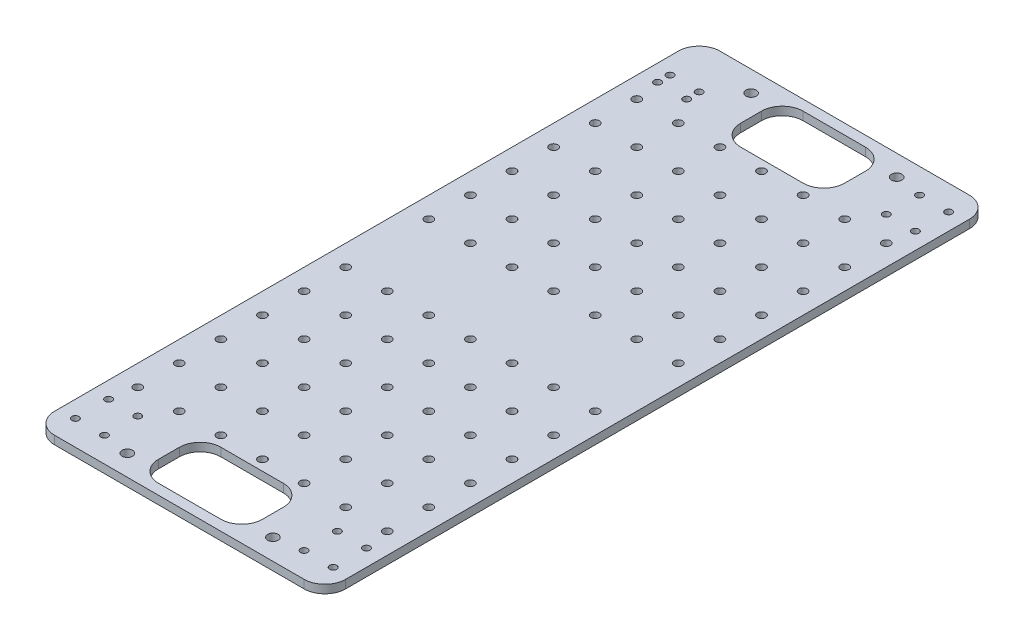
from build123d import *

# Parameters (mm, degrees)
SKETCH_1_R      = 1.7
SKETCH_1_R_2    = 2
SKETCH_1_R_3    = 2.5
EXTRUDE_2_DEPTH = 4


with BuildPart() as part:
    # 草图1 → 凸台-拉伸2 (new body)
    with BuildSketch(Plane(origin=(0, 0, 0), x_dir=(1, 0, 0), z_dir=(0, 1, 0))):
        with BuildLine():
            Line((60, 160), (0, 160))
            Line((0, 160), (-60, 160))
            ThreePointArc((-60, 160), (-67.071067812, 157.071067812), (-70, 150))
            Line((-70, 150), (-70, 0))
            Line((-70, 0), (-70, -150))
            ThreePointArc((-70, -150), (-67.071067812, -157.071067812), (-60, -160))
            Line((-60, -160), (60, -160))
            ThreePointArc((60, -160), (67.071067812, -157.071067812), (70, -150))
            Line((70, -150), (70, 150))
            ThreePointArc((70, 150), (67.071067812, 157.071067812), (60, 160))
        make_face()
        with Locations(Location((-62, 132, 0), (0, 0, 270))):
            Circle(SKETCH_1_R, mode=Mode.SUBTRACT)
        with Locations(Location((-62, -148, 0), (0, 0, 270))):
            Circle(SKETCH_1_R, mode=Mode.SUBTRACT)
        with Locations(Location((-48, -148, 0), (0, 0, 270))):
            Circle(SKETCH_1_R, mode=Mode.SUBTRACT)
        with Locations(Location((-62, -132, 0), (0, 0, 270))):
            Circle(SKETCH_1_R, mode=Mode.SUBTRACT)
        with Locations(Location((-60, -120, 0), (0, 0, 270))):
            Circle(SKETCH_1_R_2, mode=Mode.SUBTRACT)
        with Locations(Location((-48, -132, 0), (0, 0, 270))):
            Circle(SKETCH_1_R, mode=Mode.SUBTRACT)
        with Locations(Location((-35, -150, 0), (0, 0, 270))):
            Circle(SKETCH_1_R_3, mode=Mode.SUBTRACT)
        with Locations(Location((-40, -120, 0), (0, 0, 270))):
            Circle(SKETCH_1_R_2, mode=Mode.SUBTRACT)
        with Locations(Location((-60, -100, 0), (0, 0, 270))):
            Circle(SKETCH_1_R_2, mode=Mode.SUBTRACT)
        with Locations(Location((-60, -80, 0), (0, 0, 270))):
            Circle(SKETCH_1_R_2, mode=Mode.SUBTRACT)
        with Locations(Location((-40, -100, 0), (0, 0, 270))):
            Circle(SKETCH_1_R_2, mode=Mode.SUBTRACT)
        with Locations(Location((-40, -80, 0), (0, 0, 270))):
            Circle(SKETCH_1_R_2, mode=Mode.SUBTRACT)
        with Locations(Location((-20, -120, 0), (0, 0, 270))):
            Circle(SKETCH_1_R_2, mode=Mode.SUBTRACT)
        with BuildLine():
            ThreePointArc((15, -125), (22.071067812, -127.928932188), (25, -135))
            Line((25, -135), (25, -145))
            ThreePointArc((25, -145), (22.071067812, -152.071067812), (15, -155))
            Line((15, -155), (-15, -155))
            ThreePointArc((-15, -155), (-22.071067812, -152.071067812), (-25, -145))
            Line((-25, -145), (-25, -135))
            ThreePointArc((-25, -135), (-22.071067812, -127.928932188), (-15, -125))
            Line((-15, -125), (15, -125))
        make_face(mode=Mode.SUBTRACT)
        with Locations(Location((0, -120, 0), (0, 0, 270))):
            Circle(SKETCH_1_R_2, mode=Mode.SUBTRACT)
        with Locations(Location((-20, -100, 0), (0, 0, 270))):
            Circle(SKETCH_1_R_2, mode=Mode.SUBTRACT)
        with Locations(Location((-20, -80, 0), (0, 0, 270))):
            Circle(SKETCH_1_R_2, mode=Mode.SUBTRACT)
        with Locations(Location((0, -100, 0), (0, 0, 270))):
            Circle(SKETCH_1_R_2, mode=Mode.SUBTRACT)
        with Locations(Location((0, -80, 0), (0, 0, 270))):
            Circle(SKETCH_1_R_2, mode=Mode.SUBTRACT)
        with Locations(Location((-60, -60, 0), (0, 0, 270))):
            Circle(SKETCH_1_R_2, mode=Mode.SUBTRACT)
        with Locations(Location((-60, -40, 0), (0, 0, 270))):
            Circle(SKETCH_1_R_2, mode=Mode.SUBTRACT)
        with Locations(Location((-40, -60, 0), (0, 0, 270))):
            Circle(SKETCH_1_R_2, mode=Mode.SUBTRACT)
        with Locations(Location((-40, -40, 0), (0, 0, 270))):
            Circle(SKETCH_1_R_2, mode=Mode.SUBTRACT)
        with Locations(Location((-60, -20, 0), (0, 0, 270))):
            Circle(SKETCH_1_R_2, mode=Mode.SUBTRACT)
        with Locations(Location((-40, -20, 0), (0, 0, 270))):
            Circle(SKETCH_1_R_2, mode=Mode.SUBTRACT)
        with Locations(Location((-20, -60, 0), (0, 0, 270))):
            Circle(SKETCH_1_R_2, mode=Mode.SUBTRACT)
        with Locations(Location((-20, -40, 0), (0, 0, 270))):
            Circle(SKETCH_1_R_2, mode=Mode.SUBTRACT)
        with Locations(Location((0, -60, 0), (0, 0, 270))):
            Circle(SKETCH_1_R_2, mode=Mode.SUBTRACT)
        with Locations(Location((0, -40, 0), (0, 0, 270))):
            Circle(SKETCH_1_R_2, mode=Mode.SUBTRACT)
        with Locations(Location((-20, -20, 0), (0, 0, 270))):
            Circle(SKETCH_1_R_2, mode=Mode.SUBTRACT)
        with Locations(Location((0, -20, 0), (0, 0, 270))):
            Circle(SKETCH_1_R_2, mode=Mode.SUBTRACT)
        with Locations(Location((20, -120, 0), (0, 0, 270))):
            Circle(SKETCH_1_R_2, mode=Mode.SUBTRACT)
        with Locations(Location((20, -100, 0), (0, 0, 270))):
            Circle(SKETCH_1_R_2, mode=Mode.SUBTRACT)
        with Locations(Location((20, -80, 0), (0, 0, 270))):
            Circle(SKETCH_1_R_2, mode=Mode.SUBTRACT)
        with Locations(Location((35, -150, 0), (0, 0, 270))):
            Circle(SKETCH_1_R_3, mode=Mode.SUBTRACT)
        with Locations(Location((40, -120, 0), (0, 0, 270))):
            Circle(SKETCH_1_R_2, mode=Mode.SUBTRACT)
        with Locations(Location((48, -148, 0), (0, 0, 270))):
            Circle(SKETCH_1_R, mode=Mode.SUBTRACT)
        with Locations(Location((62, -148, 0), (0, 0, 270))):
            Circle(SKETCH_1_R, mode=Mode.SUBTRACT)
        with Locations(Location((48, -132, 0), (0, 0, 270))):
            Circle(SKETCH_1_R, mode=Mode.SUBTRACT)
        with Locations(Location((62, -132, 0), (0, 0, 270))):
            Circle(SKETCH_1_R, mode=Mode.SUBTRACT)
        with Locations(Location((60, -120, 0), (0, 0, 270))):
            Circle(SKETCH_1_R_2, mode=Mode.SUBTRACT)
        with Locations(Location((40, -100, 0), (0, 0, 270))):
            Circle(SKETCH_1_R_2, mode=Mode.SUBTRACT)
        with Locations(Location((40, -80, 0), (0, 0, 270))):
            Circle(SKETCH_1_R_2, mode=Mode.SUBTRACT)
        with Locations(Location((60, -100, 0), (0, 0, 270))):
            Circle(SKETCH_1_R_2, mode=Mode.SUBTRACT)
        with Locations(Location((60, -80, 0), (0, 0, 270))):
            Circle(SKETCH_1_R_2, mode=Mode.SUBTRACT)
        with Locations(Location((20, -60, 0), (0, 0, 270))):
            Circle(SKETCH_1_R_2, mode=Mode.SUBTRACT)
        with Locations(Location((20, -40, 0), (0, 0, 270))):
            Circle(SKETCH_1_R_2, mode=Mode.SUBTRACT)
        with Locations(Location((20, -20, 0), (0, 0, 270))):
            Circle(SKETCH_1_R_2, mode=Mode.SUBTRACT)
        with Locations(Location((40, -60, 0), (0, 0, 270))):
            Circle(SKETCH_1_R_2, mode=Mode.SUBTRACT)
        with Locations(Location((40, -40, 0), (0, 0, 270))):
            Circle(SKETCH_1_R_2, mode=Mode.SUBTRACT)
        with Locations(Location((60, -60, 0), (0, 0, 270))):
            Circle(SKETCH_1_R_2, mode=Mode.SUBTRACT)
        with Locations(Location((60, -40, 0), (0, 0, 270))):
            Circle(SKETCH_1_R_2, mode=Mode.SUBTRACT)
        with Locations(Location((40, -20, 0), (0, 0, 270))):
            Circle(SKETCH_1_R_2, mode=Mode.SUBTRACT)
        with Locations(Location((60, -20, 0), (0, 0, 270))):
            Circle(SKETCH_1_R_2, mode=Mode.SUBTRACT)
        with Locations(Location((-60, 20, 0), (0, 0, 270))):
            Circle(SKETCH_1_R_2, mode=Mode.SUBTRACT)
        with Locations(Location((-40, 20, 0), (0, 0, 270))):
            Circle(SKETCH_1_R_2, mode=Mode.SUBTRACT)
        with Locations(Location((-60, 40, 0), (0, 0, 270))):
            Circle(SKETCH_1_R_2, mode=Mode.SUBTRACT)
        with Locations(Location((-60, 60, 0), (0, 0, 270))):
            Circle(SKETCH_1_R_2, mode=Mode.SUBTRACT)
        with Locations(Location((-40, 40, 0), (0, 0, 270))):
            Circle(SKETCH_1_R_2, mode=Mode.SUBTRACT)
        with Locations(Location((-40, 60, 0), (0, 0, 270))):
            Circle(SKETCH_1_R_2, mode=Mode.SUBTRACT)
        with Locations(Location((-20, 20, 0), (0, 0, 270))):
            Circle(SKETCH_1_R_2, mode=Mode.SUBTRACT)
        with Locations(Location((0, 20, 0), (0, 0, 270))):
            Circle(SKETCH_1_R_2, mode=Mode.SUBTRACT)
        with Locations(Location((-20, 40, 0), (0, 0, 270))):
            Circle(SKETCH_1_R_2, mode=Mode.SUBTRACT)
        with Locations(Location((-20, 60, 0), (0, 0, 270))):
            Circle(SKETCH_1_R_2, mode=Mode.SUBTRACT)
        with Locations(Location((0, 40, 0), (0, 0, 270))):
            Circle(SKETCH_1_R_2, mode=Mode.SUBTRACT)
        with Locations(Location((0, 60, 0), (0, 0, 270))):
            Circle(SKETCH_1_R_2, mode=Mode.SUBTRACT)
        with Locations(Location((-60, 80, 0), (0, 0, 270))):
            Circle(SKETCH_1_R_2, mode=Mode.SUBTRACT)
        with Locations(Location((-60, 100, 0), (0, 0, 270))):
            Circle(SKETCH_1_R_2, mode=Mode.SUBTRACT)
        with Locations(Location((-40, 80, 0), (0, 0, 270))):
            Circle(SKETCH_1_R_2, mode=Mode.SUBTRACT)
        with Locations(Location((-40, 100, 0), (0, 0, 270))):
            Circle(SKETCH_1_R_2, mode=Mode.SUBTRACT)
        with Locations(Location((-60, 120, 0), (0, 0, 270))):
            Circle(SKETCH_1_R_2, mode=Mode.SUBTRACT)
        with Locations(Location((-48, 132, 0), (0, 0, 270))):
            Circle(SKETCH_1_R, mode=Mode.SUBTRACT)
        with Locations(Location((-62, 138, 0), (0, 0, 270))):
            Circle(SKETCH_1_R, mode=Mode.SUBTRACT)
        with Locations(Location((-48, 138, 0), (0, 0, 270))):
            Circle(SKETCH_1_R, mode=Mode.SUBTRACT)
        with Locations(Location((-40, 120, 0), (0, 0, 270))):
            Circle(SKETCH_1_R_2, mode=Mode.SUBTRACT)
        with Locations(Location((-35, 150, 0), (0, 0, 270))):
            Circle(SKETCH_1_R_3, mode=Mode.SUBTRACT)
        with Locations(Location((-20, 80, 0), (0, 0, 270))):
            Circle(SKETCH_1_R_2, mode=Mode.SUBTRACT)
        with Locations(Location((-20, 100, 0), (0, 0, 270))):
            Circle(SKETCH_1_R_2, mode=Mode.SUBTRACT)
        with Locations(Location((0, 80, 0), (0, 0, 270))):
            Circle(SKETCH_1_R_2, mode=Mode.SUBTRACT)
        with Locations(Location((0, 100, 0), (0, 0, 270))):
            Circle(SKETCH_1_R_2, mode=Mode.SUBTRACT)
        with Locations(Location((-20, 120, 0), (0, 0, 270))):
            Circle(SKETCH_1_R_2, mode=Mode.SUBTRACT)
        with Locations(Location((0, 120, 0), (0, 0, 270))):
            Circle(SKETCH_1_R_2, mode=Mode.SUBTRACT)
        with BuildLine():
            Line((-15, 155), (0, 155))
            Line((0, 155), (15, 155))
            ThreePointArc((15, 155), (22.071067812, 152.071067812), (25, 145))
            Line((25, 145), (25, 135))
            ThreePointArc((25, 135), (22.071067812, 127.928932188), (15, 125))
            Line((15, 125), (-15, 125))
            ThreePointArc((-15, 125), (-22.071067812, 127.928932188), (-25, 135))
            Line((-25, 135), (-25, 145))
            ThreePointArc((-25, 145), (-22.071067812, 152.071067812), (-15, 155))
        make_face(mode=Mode.SUBTRACT)
        with Locations(Location((20, 20, 0), (0, 0, 270))):
            Circle(SKETCH_1_R_2, mode=Mode.SUBTRACT)
        with Locations(Location((20, 40, 0), (0, 0, 270))):
            Circle(SKETCH_1_R_2, mode=Mode.SUBTRACT)
        with Locations(Location((20, 60, 0), (0, 0, 270))):
            Circle(SKETCH_1_R_2, mode=Mode.SUBTRACT)
        with Locations(Location((40, 20, 0), (0, 0, 270))):
            Circle(SKETCH_1_R_2, mode=Mode.SUBTRACT)
        with Locations(Location((60, 20, 0), (0, 0, 270))):
            Circle(SKETCH_1_R_2, mode=Mode.SUBTRACT)
        with Locations(Location((40, 40, 0), (0, 0, 270))):
            Circle(SKETCH_1_R_2, mode=Mode.SUBTRACT)
        with Locations(Location((40, 60, 0), (0, 0, 270))):
            Circle(SKETCH_1_R_2, mode=Mode.SUBTRACT)
        with Locations(Location((60, 40, 0), (0, 0, 270))):
            Circle(SKETCH_1_R_2, mode=Mode.SUBTRACT)
        with Locations(Location((60, 60, 0), (0, 0, 270))):
            Circle(SKETCH_1_R_2, mode=Mode.SUBTRACT)
        with Locations(Location((20, 80, 0), (0, 0, 270))):
            Circle(SKETCH_1_R_2, mode=Mode.SUBTRACT)
        with Locations(Location((20, 100, 0), (0, 0, 270))):
            Circle(SKETCH_1_R_2, mode=Mode.SUBTRACT)
        with Locations(Location((20, 120, 0), (0, 0, 270))):
            Circle(SKETCH_1_R_2, mode=Mode.SUBTRACT)
        with Locations(Location((40, 80, 0), (0, 0, 270))):
            Circle(SKETCH_1_R_2, mode=Mode.SUBTRACT)
        with Locations(Location((40, 100, 0), (0, 0, 270))):
            Circle(SKETCH_1_R_2, mode=Mode.SUBTRACT)
        with Locations(Location((60, 80, 0), (0, 0, 270))):
            Circle(SKETCH_1_R_2, mode=Mode.SUBTRACT)
        with Locations(Location((60, 100, 0), (0, 0, 270))):
            Circle(SKETCH_1_R_2, mode=Mode.SUBTRACT)
        with Locations(Location((40, 120, 0), (0, 0, 270))):
            Circle(SKETCH_1_R_2, mode=Mode.SUBTRACT)
        with Locations(Location((35, 150, 0), (0, 0, 270))):
            Circle(SKETCH_1_R_3, mode=Mode.SUBTRACT)
        with Locations(Location((48, 132, 0), (0, 0, 270))):
            Circle(SKETCH_1_R, mode=Mode.SUBTRACT)
        with Locations(Location((60, 120, 0), (0, 0, 270))):
            Circle(SKETCH_1_R_2, mode=Mode.SUBTRACT)
        with Locations(Location((62, 132, 0), (0, 0, 270))):
            Circle(SKETCH_1_R, mode=Mode.SUBTRACT)
        with Locations(Location((48, 148, 0), (0, 0, 270))):
            Circle(SKETCH_1_R, mode=Mode.SUBTRACT)
        with Locations(Location((62, 148, 0), (0, 0, 270))):
            Circle(SKETCH_1_R, mode=Mode.SUBTRACT)
    extrude(amount=EXTRUDE_2_DEPTH)


solid = part.part
